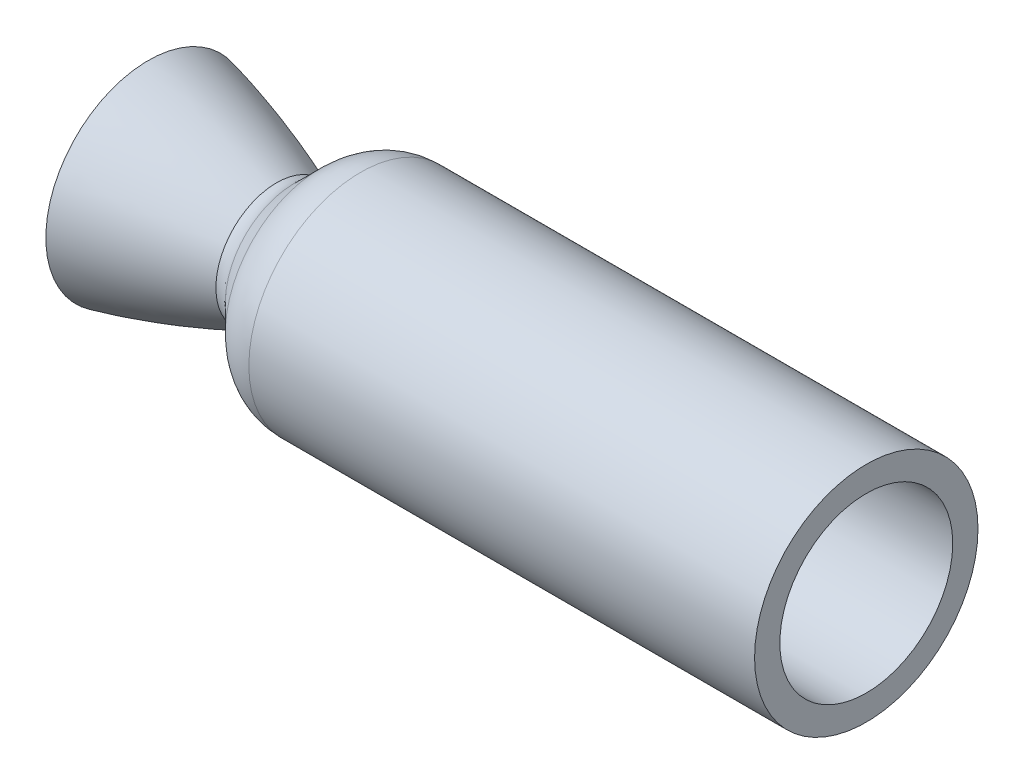
from build123d import *


with BuildPart() as part:
    # Sketch1 → Revolve1 (revolve)
    with BuildSketch(Plane.XY, mode=Mode.PRIVATE) as revolve1_sk:
        with BuildLine():
            Line((189.133015331, 27.386004017), (28.949236933, 27.386004017))
            ThreePointArc((28.949236933, 27.386004017), (25.12240261, 26.624799342), (21.878169121, 24.457071829))
            Line((21.878169121, 24.457071829), (13.541703369, 16.120606076))
            ThreePointArc((13.541703369, 16.120606076), (8.091391109, 12.478823854), (1.662309445, 11.2))
            ThreePointArc((1.662309445, 11.2), (0.81433228, 11.284876268), (0, 11.536137468))
            add(Edge.make_bspline(
                [(0, 11.536137468), (-19.948257354, 19.947595697), (-40.127010283, 24.64)],
                knots=[0, 0, 0, 1, 1, 1], degree=2))
            Line((-40.127010283, 24.64), (-38.315022829, 32.432092239))
            add(Edge.make_bspline(
                [(2.348184674, 19.226769399), (-17.827706836, 27.665327765), (-38.315022829, 32.432092239)],
                knots=[0.018493807, 0.018493807, 0.018493807, 1, 1, 1], degree=2))
            ThreePointArc((2.348184674, 19.226769399), (5.344435892, 20.007381854), (7.884849119, 21.777460326))
            Line((7.884849119, 21.777460326), (16.221314872, 30.113926078))
            ThreePointArc((16.221314872, 30.113926078), (22.060935151, 34.015835602), (28.949236933, 35.386004017))
            Line((28.949236933, 35.386004017), (189.133015331, 35.386004017))
            Line((189.133015331, 35.386004017), (189.133015331, 27.386004017))
        make_face()
    revolve(revolve1_sk.sketch.rotate(Axis((0, 0, 0), (-1, 0, 0)), 90), axis=Axis((0, 0, 0), (-1, 0, 0)))


solid = part.part
